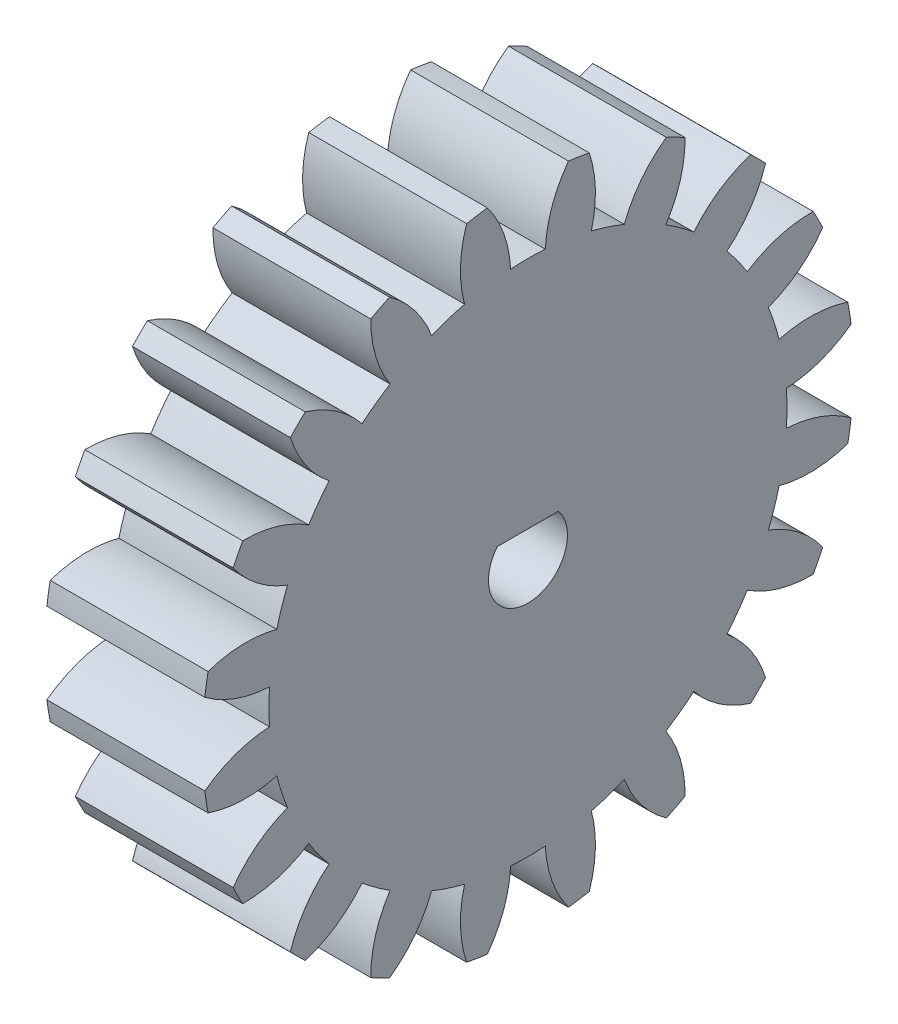
from build123d import *

# Parameters (mm, degrees)
BASPROSKE_W        = 8
BASPROSKE_H        = 16.5
TOOTHCUT_DEPTH     = 25.667792767
TEETHCUTS_COUNT    = 20
TEETHCUTS_ANGLE    = 342
BORSKE_R           = 0.4
BORE_DEPTH         = 50.0000508
CUT_EXTRUDE1_DEPTH = 25.496234031


with BuildPart() as part:
    # BasProSke → Base-Revolve (revolve)
    with BuildSketch(Plane(origin=(0, 0, 0), x_dir=(1, 0, 0), z_dir=(0, 1, 0)), mode=Mode.PRIVATE) as base_revolve_sk:
        with Locations((4, 8.25)):
            Rectangle(BASPROSKE_W, BASPROSKE_H)
    revolve(base_revolve_sk.sketch.rotate(Axis((-10, 0, 0), (1, 0, 0)), 180), axis=Axis((-10, 0, 0), (1, 0, 0)))

    # TooCutSke → ToothCut (cut, through all)
    with BuildSketch(Plane(origin=(0, 0, 0), x_dir=(0, 0, -1), z_dir=(1, 0, 0))):
        with BuildLine():
            ThreePointArc((0.877929023, 13.094602576), (0, 13.124), (-0.877929023, 13.094602576))
            ThreePointArc((-0.877929023, 13.094602576), (-1.227785764, 14.834041313), (-2.071065599, 16.395106966))
            ThreePointArc((-2.071065599, 16.395106966), (0, 16.5254), (2.071065599, 16.395106966))
            ThreePointArc((2.071065599, 16.395106966), (1.227785764, 14.834041313), (0.877929023, 13.094602576))
        make_face()
    toothcut = extrude(amount=TOOTHCUT_DEPTH, mode=Mode.SUBTRACT)

    # TeethCuts: ToothCut ×20 about axis
    teethcuts_axis = Axis((-10, 0, 0), (1, 0, 0))
    for i in range(1, TEETHCUTS_COUNT):
        add(toothcut.rotate(teethcuts_axis, i * TEETHCUTS_ANGLE / (TEETHCUTS_COUNT - 1)), mode=Mode.SUBTRACT)

    # BorSke → Bore (cut, symmetric)
    with BuildSketch(Plane(origin=(0, 0, 0), x_dir=(0, 0, -1), z_dir=(1, 0, 0))):
        with Locations(Location((0, 0, 0), (0, 0, 180))):
            Circle(BORSKE_R)
    extrude(amount=BORE_DEPTH, both=True, mode=Mode.SUBTRACT)

    # Sketch1 → Cut-Extrude1 (cut, through all)
    with BuildSketch(Plane(origin=(8, 0, 0), x_dir=(0, 0, -1), z_dir=(1, 0, 0))):
        with BuildLine():
            ThreePointArc((2, 0), (1.8851176, 0.668080559), (1.553668367, 1.25941042))
            Line((1.553668367, 1.25941042), (-1.553668367, 1.25941042))
            ThreePointArc((-1.553668367, 1.25941042), (-0.668080559, -1.8851176), (2, 0))
        make_face()
    extrude(amount=-CUT_EXTRUDE1_DEPTH, mode=Mode.SUBTRACT)


solid = part.part
